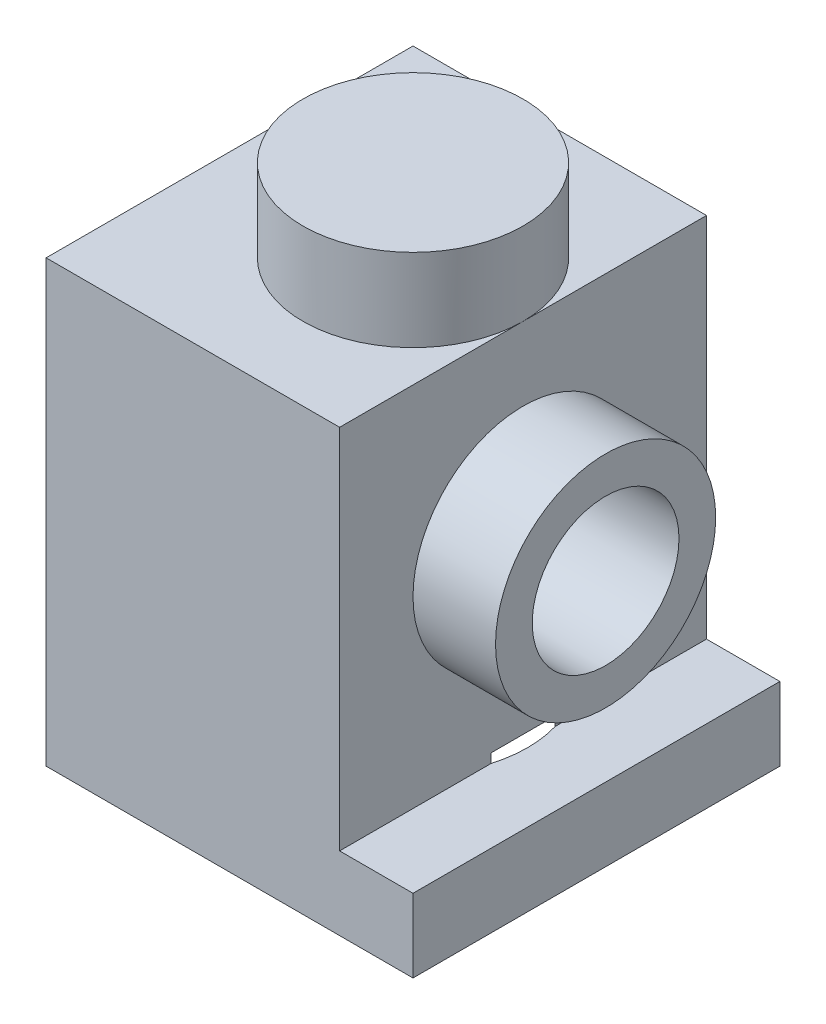
from build123d import *

# Parameters (mm, degrees)
SKETCH_1_W          = 8
SKETCH_1_H          = 8
EXTRUDE_1_DEPTH     = 9.6
SKETCH_2_W          = 1.6
SKETCH_2_H          = 8
CUT_EXTRUDE_1_DEPTH = 8
SKETCH_5_R          = 2.4
EXTRUDE_2_DEPTH     = 1.8
SKETCH_8_R          = 1.6
CUT_EXTRUDE_3_DEPTH = 9
SKETCH_9_R          = 2.4
EXTRUDE_3_DEPTH     = 1.8
SKETCH_13_W         = 4.8
SKETCH_13_H         = 4.803439306
CUT_EXTRUDE_4_DEPTH = 5
SKETCH_15_R         = 2.5
CUT_EXTRUDE_5_DEPTH = 1.8


with BuildPart() as part:
    # Эскиз1 → Бобышка-Вытянуть1 (new body)
    with BuildSketch(Plane(origin=(0, 0, 0), x_dir=(1, 0, 0), z_dir=(0, 1, 0))):
        Rectangle(SKETCH_1_W, SKETCH_1_H)
    extrude(amount=EXTRUDE_1_DEPTH)

    # Эскиз2 → Вырез-Вытянуть1 (cut)
    with BuildSketch(Plane(origin=(0, 9.6, 0), x_dir=(1, 0, 0), z_dir=(0, 1, 0))):
        with Locations((3.2, 0)):
            Rectangle(SKETCH_2_W, SKETCH_2_H)
    extrude(amount=-CUT_EXTRUDE_1_DEPTH, mode=Mode.SUBTRACT)

    # Эскиз5 → Бобышка-Вытянуть2 (add)
    with BuildSketch(Plane(origin=(2.4, 0, 0), x_dir=(0, 0, -1), z_dir=(1, 0, 0))):
        with Locations(Location((0, 5.6, 0), (0, 0, 180))):
            Circle(SKETCH_5_R)
    extrude(amount=EXTRUDE_2_DEPTH)

    # Эскиз8 → Вырез-Вытянуть3 (cut)
    with BuildSketch(Plane(origin=(4.2, 0, 0), x_dir=(0, 0, -1), z_dir=(1, 0, 0))):
        with Locations((0, 5.6)):
            Circle(SKETCH_8_R)
    extrude(amount=-CUT_EXTRUDE_3_DEPTH, mode=Mode.SUBTRACT)

    # Эскиз9 → Бобышка-Вытянуть3 (add)
    with BuildSketch(Plane(origin=(0, 9.6, 0), x_dir=(1, 0, 0), z_dir=(0, 1, 0))):
        Circle(SKETCH_9_R)
    extrude(amount=EXTRUDE_3_DEPTH)

    # Эскиз13 → Вырез-Вытянуть4 (cut)
    with BuildSketch(Plane.ZY.offset(4)):
        with Locations((0, 5.6)):
            Rectangle(SKETCH_13_W, SKETCH_13_H)
    extrude(amount=-CUT_EXTRUDE_4_DEPTH, mode=Mode.SUBTRACT)

    # Эскиз15 → Вырез-Вытянуть5 (cut)
    with BuildSketch(Plane.XZ):
        with Locations(Location((0, 0, 0), (0, 0, 270))):
            Circle(SKETCH_15_R)
    extrude(amount=-CUT_EXTRUDE_5_DEPTH, mode=Mode.SUBTRACT)


solid = part.part
